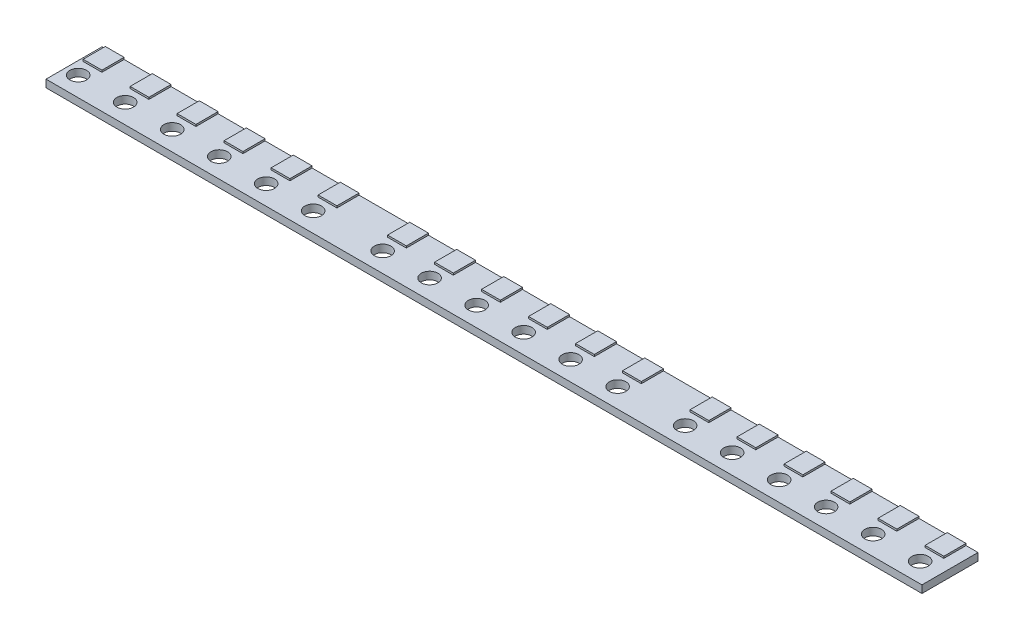
from build123d import *

# Parameters (mm, degrees)
SKETCH1_W                = 96.52
SKETCH1_H                = 8.9916
MAIN_BOSS_DEPTH          = 0.8
SKETCH2_R                = 0.889
HOLES_FOR_PNP_PINS_DEPTH = 97.941215541
SKETCH3_W                = 2
SKETCH3_H                = 2.54
LOCATOR_TABS_DEPTH       = 0.2
SKETCH4_W                = 101.202450421
SKETCH4_H                = 13.068973156
SKETCH4_W_2              = 93.255989356
SKETCH4_H_2              = 5.969
CROP_DEPTH               = 97.943072319


with BuildPart() as part:
    # Sketch1 → main boss (new body)
    with BuildSketch(Plane(origin=(0, 0, 0), x_dir=(1, 0, 0), z_dir=(0, 1, 0))):
        with Locations((48.26, 4.4958)):
            Rectangle(SKETCH1_W, SKETCH1_H)
    extrude(amount=MAIN_BOSS_DEPTH)

    # Sketch2 → holes for PNP pins (cut, through all)
    with BuildSketch(Plane(origin=(0, 0, 0), x_dir=(1, 0, 0), z_dir=(0, 1, 0))):
        with Locations(Location((2.54, 3.9878, 0), (0, 0, 270))):
            Circle(SKETCH2_R)
        with Locations(Location((7.5438, 3.9878, 0), (0, 0, 270))):
            Circle(SKETCH2_R)
        with Locations(Location((12.5476, 3.9878, 0), (0, 0, 270))):
            Circle(SKETCH2_R)
        with Locations(Location((17.5514, 3.9878, 0), (0, 0, 270))):
            Circle(SKETCH2_R)
        with Locations(Location((22.5552, 3.9878, 0), (0, 0, 270))):
            Circle(SKETCH2_R)
        with Locations(Location((27.559, 3.9878, 0), (0, 0, 270))):
            Circle(SKETCH2_R)
        with Locations(Location((34.9504, 3.9878, 0), (0, 0, 270))):
            Circle(SKETCH2_R)
        with Locations(Location((39.9542, 3.9878, 0), (0, 0, 270))):
            Circle(SKETCH2_R)
        with Locations(Location((44.958, 3.9878, 0), (0, 0, 270))):
            Circle(SKETCH2_R)
        with Locations(Location((49.9618, 3.9878, 0), (0, 0, 270))):
            Circle(SKETCH2_R)
        with Locations(Location((54.9656, 3.9878, 0), (0, 0, 270))):
            Circle(SKETCH2_R)
        with Locations(Location((59.9694, 3.9878, 0), (0, 0, 270))):
            Circle(SKETCH2_R)
        with Locations(Location((67.1576, 3.9878, 0), (0, 0, 270))):
            Circle(SKETCH2_R)
        with Locations(Location((72.1614, 3.9878, 0), (0, 0, 270))):
            Circle(SKETCH2_R)
        with Locations(Location((77.1652, 3.9878, 0), (0, 0, 270))):
            Circle(SKETCH2_R)
        with Locations(Location((82.169, 3.9878, 0), (0, 0, 270))):
            Circle(SKETCH2_R)
        with Locations(Location((87.1728, 3.9878, 0), (0, 0, 270))):
            Circle(SKETCH2_R)
        with Locations(Location((92.1766, 3.9878, 0), (0, 0, 270))):
            Circle(SKETCH2_R)
    extrude(amount=HOLES_FOR_PNP_PINS_DEPTH, mode=Mode.SUBTRACT)

    # Sketch3 → locator tabs (add)
    with BuildSketch(Plane(origin=(0, 0.8, 0), x_dir=(1, 0, 0), z_dir=(0, 1, 0))):
        with Locations((7.5438, 6.7818)):
            Rectangle(SKETCH3_W, SKETCH3_H)
        with Locations((2.54, 6.7818)):
            Rectangle(SKETCH3_W, SKETCH3_H)
        with Locations((34.9504, 6.7818)):
            Rectangle(SKETCH3_W, SKETCH3_H)
        with Locations((67.1576, 6.7818)):
            Rectangle(SKETCH3_W, SKETCH3_H)
        with Locations((12.5476, 6.7818)):
            Rectangle(SKETCH3_W, SKETCH3_H)
        with Locations((17.5514, 6.7818)):
            Rectangle(SKETCH3_W, SKETCH3_H)
        with Locations((22.5552, 6.7818)):
            Rectangle(SKETCH3_W, SKETCH3_H)
        with Locations((27.559, 6.7818)):
            Rectangle(SKETCH3_W, SKETCH3_H)
        with Locations((39.9542, 6.7818)):
            Rectangle(SKETCH3_W, SKETCH3_H)
        with Locations((44.958, 6.7818)):
            Rectangle(SKETCH3_W, SKETCH3_H)
        with Locations((49.9618, 6.7818)):
            Rectangle(SKETCH3_W, SKETCH3_H)
        with Locations((54.9656, 6.7818)):
            Rectangle(SKETCH3_W, SKETCH3_H)
        with Locations((59.9694, 6.7818)):
            Rectangle(SKETCH3_W, SKETCH3_H)
        with Locations((72.1614, 6.7818)):
            Rectangle(SKETCH3_W, SKETCH3_H)
        with Locations((77.1652, 6.7818)):
            Rectangle(SKETCH3_W, SKETCH3_H)
        with Locations((82.169, 6.7818)):
            Rectangle(SKETCH3_W, SKETCH3_H)
        with Locations((87.1728, 6.7818)):
            Rectangle(SKETCH3_W, SKETCH3_H)
        with Locations((92.1766, 6.7818)):
            Rectangle(SKETCH3_W, SKETCH3_H)
    extrude(amount=LOCATOR_TABS_DEPTH)

    # Sketch4 → crop (cut, through all)
    with BuildSketch(Plane(origin=(0, 0, 0), x_dir=(1, 0, 0), z_dir=(0, 1, 0))):
        with Locations((47.986811927, 3.888963456)):
            Rectangle(SKETCH4_W, SKETCH4_H)
        with Locations((47.822628847, 4.8895)):
            Rectangle(SKETCH4_W_2, SKETCH4_H_2, mode=Mode.SUBTRACT)
    extrude(amount=CROP_DEPTH, mode=Mode.SUBTRACT)


solid = part.part
